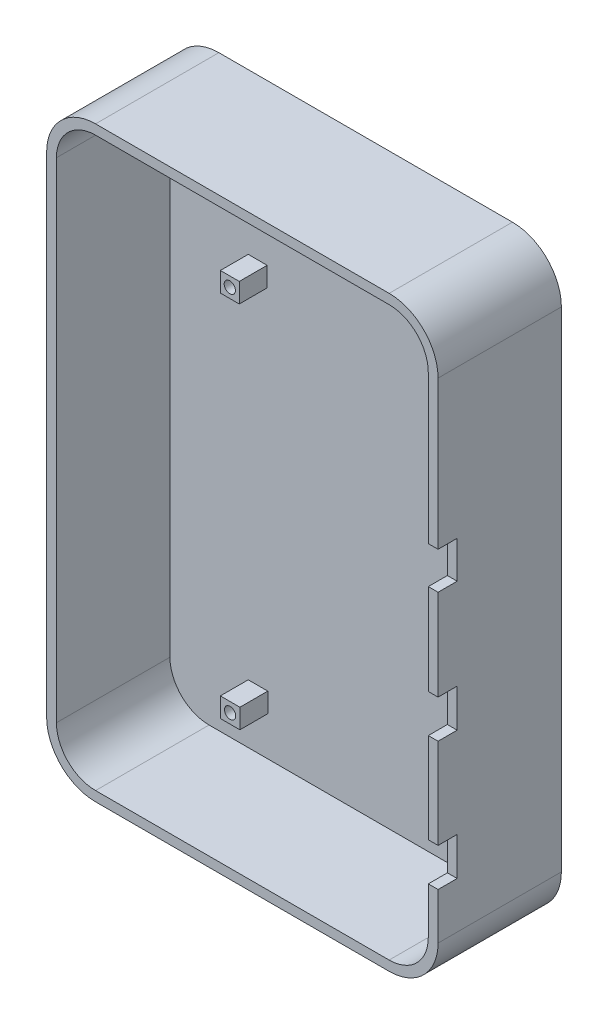
from build123d import *

# Parameters (mm, degrees)
BOSS_EXTRU_3_DEPTH = 2
BOSS_EXTRU_4_DEPTH = 19.3
ESQUISSE4_W        = 2
ESQUISSE4_H        = 18.565
ESQUISSE4_H_2      = 18.45
BOSS_EXTRU_5_DEPTH = 3.9
ESQUISSE5_W        = 4
ESQUISSE5_H        = 4
ESQUISSE5_R        = 1.15
ESQUISSE5_W_2      = 3.87
ESQUISSE5_H_2      = 3.3
BOSS_EXTRU_6_DEPTH = 5.7


with BuildPart() as part:
    # Esquisse1 → Boss.-Extru.3 (new body)
    with BuildSketch(Plane.XY):
        with BuildLine():
            Line((-70, 0), (-10.000000065, 0))
            ThreePointArc((-10.000000065, 0), (-2.928932211, 2.928932165), (0, 10))
            Line((0, 10), (0, 110))
            ThreePointArc((0, 110), (-2.928932188, 117.071067812), (-10, 120))
            Line((-10, 120), (-70, 120))
            ThreePointArc((-70, 120), (-77.071067812, 117.071067812), (-80, 110))
            Line((-80, 110), (-80, 10))
            ThreePointArc((-80, 10), (-77.071067812, 2.928932188), (-70, 0))
        make_face()
    extrude(amount=BOSS_EXTRU_3_DEPTH)

    # Esquisse3 → Boss.-Extru.4 (add)
    with BuildSketch(Plane.XY.offset(2)):
        with BuildLine():
            ThreePointArc((-80, 10), (-79.486832981, 6.83772234), (-78, 4))
            Line((-78, 4), (-78, 10))
            Line((-78, 10), (-78, 16))
            ThreePointArc((-78, 16), (-79.486832981, 13.16227766), (-80, 10))
        make_face()
        with BuildLine():
            ThreePointArc((-78, 4), (-77.071067812, 2.928932188), (-76, 2))
            Line((-76, 2), (-70, 2))
            ThreePointArc((-70, 2), (-75.656854249, 4.343145751), (-78, 10))
            Line((-78, 10), (-78, 4))
        make_face()
        with BuildLine():
            ThreePointArc((-76, 2), (-73.16227766, 0.513167019), (-70, 0))
            ThreePointArc((-70, 0), (-66.83772234, 0.513167019), (-64, 2))
            Line((-64, 2), (-70, 2))
            Line((-70, 2), (-76, 2))
        make_face()
        with BuildLine():
            Line((-70, 0), (-10, 0))
            ThreePointArc((-10, 0), (-13.16227766, 0.513167019), (-16, 2))
            Line((-16, 2), (-64, 2))
            ThreePointArc((-64, 2), (-66.83772234, 0.513167019), (-70, 0))
        make_face()
        with BuildLine():
            ThreePointArc((-80, 10), (-79.486832981, 13.16227766), (-78, 16))
            Line((-78, 16), (-78, 104))
            ThreePointArc((-78, 104), (-79.486832981, 106.83772234), (-80, 110))
            Line((-80, 110), (-80, 10))
        make_face()
        with BuildLine():
            ThreePointArc((-80, 110), (-79.486832981, 106.83772234), (-78, 104))
            Line((-78, 104), (-78, 110))
            Line((-78, 110), (-78, 116))
            ThreePointArc((-78, 116), (-79.486832981, 113.16227766), (-80, 110))
        make_face()
        with BuildLine():
            ThreePointArc((-78, 110), (-75.656854249, 115.656854249), (-70, 118))
            Line((-70, 118), (-76, 118))
            ThreePointArc((-76, 118), (-77.071067812, 117.071067812), (-78, 116))
            Line((-78, 116), (-78, 110))
        make_face()
        with BuildLine():
            Line((-70, 118), (-64, 118))
            ThreePointArc((-64, 118), (-66.83772234, 119.486832981), (-70, 120))
            ThreePointArc((-70, 120), (-73.16227766, 119.486832981), (-76, 118))
            Line((-76, 118), (-70, 118))
        make_face()
        with BuildLine():
            Line((-64, 118), (-16, 118))
            ThreePointArc((-16, 118), (-13.16227766, 119.486832981), (-10, 120))
            Line((-10, 120), (-70, 120))
            ThreePointArc((-70, 120), (-66.83772234, 119.486832981), (-64, 118))
        make_face()
        with BuildLine():
            ThreePointArc((-10, 120), (-13.16227766, 119.486832981), (-16, 118))
            Line((-16, 118), (-10, 118))
            Line((-10, 118), (-4, 118))
            ThreePointArc((-4, 118), (-6.83772234, 119.486832981), (-10, 120))
        make_face()
        with BuildLine():
            Line((-2, 110), (-2, 116))
            ThreePointArc((-2, 116), (-2.928932188, 117.071067812), (-4, 118))
            Line((-4, 118), (-10, 118))
            ThreePointArc((-10, 118), (-4.343145751, 115.656854249), (-2, 110))
        make_face()
        with BuildLine():
            ThreePointArc((-2, 104), (-0.513167019, 106.83772234), (0, 110))
            ThreePointArc((0, 110), (-0.513167019, 113.16227766), (-2, 116))
            Line((-2, 116), (-2, 110))
            Line((-2, 110), (-2, 104))
        make_face()
        with BuildLine():
            ThreePointArc((-2, 16), (-0.513167019, 13.16227766), (0, 10))
            Line((0, 10), (0, 110))
            ThreePointArc((0, 110), (-0.513167019, 106.83772234), (-2, 104))
            Line((-2, 104), (-2, 16))
        make_face()
        with BuildLine():
            Line((-2, 10), (-2, 4))
            ThreePointArc((-2, 4), (-0.513167019, 6.83772234), (0, 10))
            ThreePointArc((0, 10), (-0.513167019, 13.16227766), (-2, 16))
            Line((-2, 16), (-2, 10))
        make_face()
        with BuildLine():
            Line((-10, 2), (-4, 2))
            ThreePointArc((-4, 2), (-2.928932188, 2.928932188), (-2, 4))
            Line((-2, 4), (-2, 10))
            ThreePointArc((-2, 10), (-4.343145751, 4.343145751), (-10, 2))
        make_face()
        with BuildLine():
            ThreePointArc((-10, 0), (-6.83772234, 0.513167019), (-4, 2))
            Line((-4, 2), (-10, 2))
            Line((-10, 2), (-16, 2))
            ThreePointArc((-16, 2), (-13.16227766, 0.513167019), (-10, 0))
        make_face()
    extrude(amount=BOSS_EXTRU_4_DEPTH)

    # Esquisse4 → Boss.-Extru.5 (add)
    with BuildSketch(Plane.XY.offset(21.3)):
        with BuildLine():
            Line((-64, 118), (-16, 118))
            ThreePointArc((-16, 118), (-13.16227766, 119.486832981), (-10, 120))
            Line((-10, 120), (-70, 120))
            ThreePointArc((-70, 120), (-66.83772234, 119.486832981), (-64, 118))
        make_face()
        with BuildLine():
            Line((-70, 118), (-64, 118))
            ThreePointArc((-64, 118), (-66.83772234, 119.486832981), (-70, 120))
            ThreePointArc((-70, 120), (-77.071067812, 117.071067812), (-80, 110))
            ThreePointArc((-80, 110), (-79.486832981, 106.83772234), (-78, 104))
            Line((-78, 104), (-78, 110))
            ThreePointArc((-78, 110), (-75.656854249, 115.656854249), (-70, 118))
        make_face()
        with BuildLine():
            Line((-2, 110), (-2, 104))
            ThreePointArc((-2, 104), (-0.513167019, 106.83772234), (0, 110))
            ThreePointArc((0, 110), (-2.928932188, 117.071067812), (-10, 120))
            ThreePointArc((-10, 120), (-13.16227766, 119.486832981), (-16, 118))
            Line((-16, 118), (-10, 118))
            ThreePointArc((-10, 118), (-4.343145751, 115.656854249), (-2, 110))
        make_face()
        with BuildLine():
            Line((-2, 104), (-2, 79.7))
            Line((-2, 79.7), (0, 79.7))
            Line((0, 79.7), (0, 110))
            ThreePointArc((0, 110), (-0.513167019, 106.83772234), (-2, 104))
        make_face()
        with Locations((-1, 62.8175)):
            Rectangle(ESQUISSE4_W, ESQUISSE4_H)
        with Locations((-1, 36.51)):
            Rectangle(ESQUISSE4_W, ESQUISSE4_H_2)
        with BuildLine():
            Line((0, 19.485), (-2, 19.485))
            Line((-2, 19.485), (-2, 16))
            ThreePointArc((-2, 16), (-0.513167019, 13.16227766), (0, 10))
            Line((0, 10), (0, 19.485))
        make_face()
        with BuildLine():
            ThreePointArc((0, 10), (-0.513167019, 13.16227766), (-2, 16))
            Line((-2, 16), (-2, 10))
            ThreePointArc((-2, 10), (-4.343145751, 4.343145751), (-10, 2))
            Line((-10, 2), (-16, 2))
            ThreePointArc((-16, 2), (-13.16227766, 0.513167019), (-10, 0))
            ThreePointArc((-10, 0), (-2.928932188, 2.928932188), (0, 10))
        make_face()
        with BuildLine():
            ThreePointArc((-64, 2), (-66.83772234, 0.513167019), (-70, 0))
            Line((-70, 0), (-10, 0))
            ThreePointArc((-10, 0), (-13.16227766, 0.513167019), (-16, 2))
            Line((-16, 2), (-64, 2))
        make_face()
        with BuildLine():
            ThreePointArc((-78, 16), (-79.486832981, 13.16227766), (-80, 10))
            ThreePointArc((-80, 10), (-77.071067812, 2.928932188), (-70, 0))
            ThreePointArc((-70, 0), (-66.83772234, 0.513167019), (-64, 2))
            Line((-64, 2), (-70, 2))
            ThreePointArc((-70, 2), (-75.656854249, 4.343145751), (-78, 10))
            Line((-78, 10), (-78, 16))
        make_face()
        with BuildLine():
            ThreePointArc((-78, 104), (-79.486832981, 106.83772234), (-80, 110))
            Line((-80, 110), (-80, 10))
            ThreePointArc((-80, 10), (-79.486832981, 13.16227766), (-78, 16))
            Line((-78, 16), (-78, 104))
        make_face()
    extrude(amount=BOSS_EXTRU_5_DEPTH)

    # Esquisse5 → Boss.-Extru.6 (add)
    # profile 1 of 4: a face of its own
    with BuildSketch(Plane.XY.offset(2)):
        with Locations((-4, 12)):
            Rectangle(ESQUISSE5_W, ESQUISSE5_H)
        with Locations((-4, 12)):
            Circle(ESQUISSE5_R, mode=Mode.SUBTRACT)
    # profile 2 of 4: a face of its own
    with BuildSketch(Plane.XY.offset(2)):
        with Locations((-60, 12)):
            Rectangle(ESQUISSE5_W, ESQUISSE5_H)
        with Locations((-60, 12)):
            Circle(ESQUISSE5_R, mode=Mode.SUBTRACT)
    # profile 3 of 4: a face of its own
    with BuildSketch(Plane.XY.offset(2)):
        with Locations((-60.065, 87.3)):
            Rectangle(ESQUISSE5_W_2, ESQUISSE5_H)
        with Locations((-60.065, 87.3)):
            Circle(ESQUISSE5_R, mode=Mode.SUBTRACT)
    # profile 4 of 4: a face of its own
    with BuildSketch(Plane.XY.offset(2)):
        with Locations((-4, 87.65)):
            Rectangle(ESQUISSE5_W, ESQUISSE5_H_2)
        with Locations((-4, 87.65)):
            Circle(ESQUISSE5_R, mode=Mode.SUBTRACT)
    extrude(amount=BOSS_EXTRU_6_DEPTH)


solid = part.part
